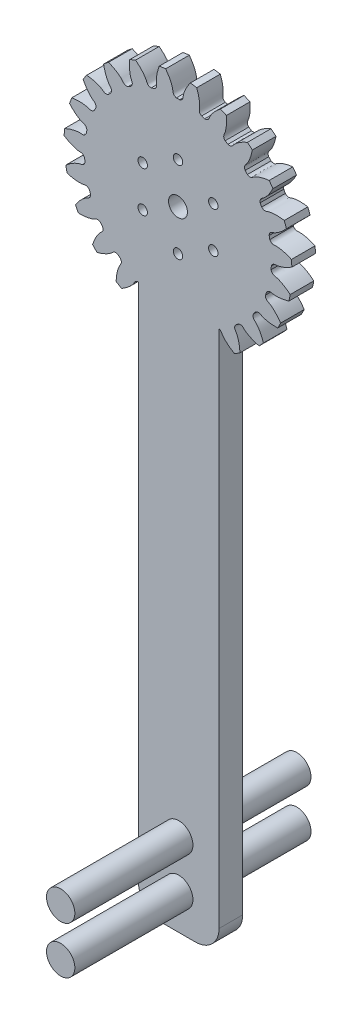
from build123d import *

# Parameters (mm, degrees)
SKETCH_1_R               = 48.25
EXTRUDE_1_DEPTH          = 10
CUT_EXTRUDE_1_DEPTH      = 69.964664865
PATTERN_CIRCULAR_1_COUNT = 23
SKETCH_5_W               = 34.161088376
SKETCH_5_H               = 266
EXTRUDE_5_DEPTH          = 10
SKETCH_6_R               = 2
CUT_EXTRUDE_3_DEPTH      = 169
SKETCH_14_R              = 6
EXTRUDE_8_DEPTH          = 50
SKETCH_15_R              = 4
CUT_EXTRUDE_4_DEPTH      = 27
FILLET_1_R               = 10
FILLET_2_R               = 10


with BuildPart() as part:
    # 草图1 → 凸台-拉伸1 (new body)
    with BuildSketch(Plane.XY):
        Circle(SKETCH_1_R)
    extrude(amount=EXTRUDE_1_DEPTH)

    # 草图2 → 切除-拉伸1 (cut, through all)
    with BuildSketch(Plane.XY):
        with BuildLine():
            ThreePointArc((0.700117739, 39.55880509), (0, 39.565), (-0.700117739, 39.55880509))
            add(Edge.make_bspline(
                [(-0.700117739, 39.55880509), (-2.230051257, 40.01570508), (-2.098914789, 41.046611477), (-2.288709546, 42.06309924), (-2.314061981, 42.185649143), (-2.345575626, 42.323935079), (-2.383864932, 42.47775829), (-2.429569872, 42.646894953), (-2.483314136, 42.831104069), (-2.54571772, 43.030125172), (-2.617392338, 43.243679276), (-2.698942172, 43.471468827), (-2.790963, 43.713177983), (-2.894041818, 43.968472807), (-3.008756324, 44.237001499), (-3.135674445, 44.518394641), (-3.275353865, 44.812265445), (-3.428341558, 45.118210016), (-3.595173329, 45.435807635), (-3.776373358, 45.764621039), (-3.972453757, 46.104196727), (-4.183914129, 46.454065263), (-4.411241138, 46.813741602), (-4.654908088, 47.182725423), (-4.915374502, 47.560501466), (-5.193085722, 47.946539892), (-5.488472508, 48.340296641), (-5.801950649, 48.741213807), (-6.133920582, 49.148720026), (-6.484767024, 49.562230859), (-6.85485861, 49.981149205), (-7.244547542, 50.404865706), (-7.654169248, 50.832759169), (-8.08404205, 51.264196994), (-8.534466847, 51.698535616), (-9.005726803, 52.135120945), (-9.498087043, 52.573288825), (-10.011794403, 53.012365488), (-10.547076998, 53.451668039), (-11.298572056, 54.043667554), (-11.882201151, 54.475393164), (-12.281287755, 54.75871483)],
                knots=[0, 0, 0, 0, 0.147386897, 0.152959532, 0.159389495, 0.166676786, 0.174821406, 0.183823355, 0.193682632, 0.204399237, 0.21597317, 0.228404432, 0.241693023, 0.255838942, 0.270842189, 0.286702764, 0.303420668, 0.320995901, 0.339428462, 0.358718351, 0.378865568, 0.399870114, 0.421731989, 0.444451192, 0.468027723, 0.492461582, 0.517752771, 0.543901287, 0.570907132, 0.598770305, 0.627490807, 0.657068637, 0.687503795, 0.718796282, 0.750946098, 0.783953241, 0.817817713, 0.852539514, 0.888118643, 0.9245551, 1, 1, 1, 1], degree=3))
            ThreePointArc((-12.281287755, 54.75871483), (0, 56.119042034), (12.281287755, 54.75871483))
            add(Edge.make_bspline(
                [(0.700117739, 39.55880509), (2.230051257, 40.01570508), (2.098914789, 41.046611477), (2.288709546, 42.06309924), (2.314061981, 42.185649143), (2.345575626, 42.323935079), (2.383864932, 42.47775829), (2.429569872, 42.646894953), (2.483314136, 42.831104069), (2.54571772, 43.030125172), (2.617392338, 43.243679276), (2.698942172, 43.471468827), (2.790963, 43.713177983), (2.894041818, 43.968472807), (3.008756324, 44.237001499), (3.135674445, 44.518394641), (3.275353865, 44.812265445), (3.428341558, 45.118210016), (3.595173329, 45.435807635), (3.776373358, 45.764621039), (3.972453757, 46.104196727), (4.183914129, 46.454065263), (4.411241138, 46.813741602), (4.654908088, 47.182725423), (4.915374502, 47.560501466), (5.193085722, 47.946539892), (5.488472508, 48.340296641), (5.801950649, 48.741213807), (6.133920582, 49.148720026), (6.484767024, 49.562230859), (6.85485861, 49.981149205), (7.244547542, 50.404865706), (7.654169248, 50.832759169), (8.08404205, 51.264196994), (8.534466847, 51.698535616), (9.005726803, 52.135120945), (9.498087043, 52.573288825), (10.011794403, 53.012365488), (10.547076998, 53.451668039), (11.298572056, 54.043667554), (11.882201151, 54.475393164), (12.281287755, 54.75871483)],
                knots=[0, 0, 0, 0, 0.147386897, 0.152959532, 0.159389495, 0.166676786, 0.174821406, 0.183823355, 0.193682632, 0.204399237, 0.21597317, 0.228404432, 0.241693023, 0.255838942, 0.270842189, 0.286702764, 0.303420668, 0.320995901, 0.339428462, 0.358718351, 0.378865568, 0.399870114, 0.421731989, 0.444451192, 0.468027723, 0.492461582, 0.517752771, 0.543901287, 0.570907132, 0.598770305, 0.627490807, 0.657068637, 0.687503795, 0.718796282, 0.750946098, 0.783953241, 0.817817713, 0.852539514, 0.888118643, 0.9245551, 1, 1, 1, 1], degree=3))
        make_face()
    cut_extrude_1 = extrude(amount=CUT_EXTRUDE_1_DEPTH, mode=Mode.SUBTRACT)

    # 阵列(圆周)1: 切除-拉伸1 ×23 about axis
    pattern_circular_1_axis = Axis((0, 0, -1.5), (0, 0, 1))
    for i in range(1, PATTERN_CIRCULAR_1_COUNT):
        add(cut_extrude_1.rotate(pattern_circular_1_axis, i * 360 / PATTERN_CIRCULAR_1_COUNT), mode=Mode.SUBTRACT)

    # 草图5 → 凸台-拉伸5 (add)
    with BuildSketch(Plane.XY.offset(10)):
        with Locations((0.317926578, -133)):
            Rectangle(SKETCH_5_W, SKETCH_5_H)
    extrude(amount=-EXTRUDE_5_DEPTH)

    # 草图6 → 切除-拉伸3 (cut)
    with BuildSketch(Plane.XY.offset(10)):
        with Locations((0, 17.25)):
            Circle(SKETCH_6_R)
        with Locations((14.938938215, 8.625)):
            Circle(SKETCH_6_R)
        with Locations((14.938938215, -8.625)):
            Circle(SKETCH_6_R)
        with Locations((0, -17.25)):
            Circle(SKETCH_6_R)
        with Locations((-14.938938215, -8.625)):
            Circle(SKETCH_6_R)
        with Locations((-14.938938215, 8.625)):
            Circle(SKETCH_6_R)
    extrude(amount=-CUT_EXTRUDE_3_DEPTH, mode=Mode.SUBTRACT)

    # 草图14 → 凸台-拉伸8 (add, symmetric)
    with BuildSketch(Plane.XY.offset(10)):
        with Locations((0.317926578, -251)):
            Circle(SKETCH_14_R)
        with Locations((0.317926578, -231)):
            Circle(SKETCH_14_R)
    extrude(amount=EXTRUDE_8_DEPTH, both=True)

    # 草图15 → 切除-拉伸4 (cut)
    with BuildSketch(Plane(origin=(0, 0, 0), x_dir=(-1, 0, 0), z_dir=(0, 0, -1))):
        Circle(SKETCH_15_R)
    extrude(amount=-CUT_EXTRUDE_4_DEPTH, mode=Mode.SUBTRACT)

    # 圆角1
    fillet_1_edges = [part.edges().sort_by_distance(p)[0] for p in [
        (-16.76261761, -266, 5),
    ]]
    fillet(fillet_1_edges, radius=FILLET_1_R)

    # 圆角2
    fillet_2_edges = [part.edges().sort_by_distance(p)[0] for p in [
        (17.398470766, -266, 5),
    ]]
    fillet(fillet_2_edges, radius=FILLET_2_R)


solid = part.part
